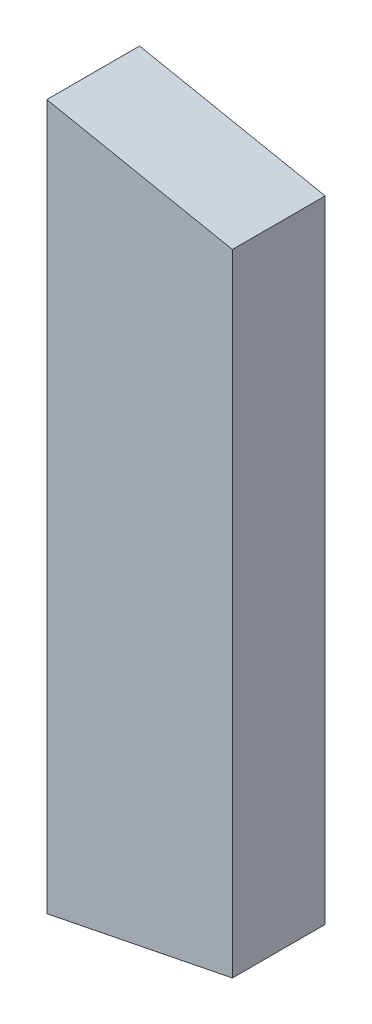
from build123d import *

# Parameters (mm, degrees)
SKETCH1_W           = 10
SKETCH1_H           = 38
BOSS_EXTRUDE1_DEPTH = 5
CUT_EXTRUDE1_DEPTH  = 27


with BuildPart() as part:
    # Sketch1 → Boss-Extrude1 (new body)
    with BuildSketch(Plane.XY):
        Rectangle(SKETCH1_W, SKETCH1_H)
    extrude(amount=BOSS_EXTRUDE1_DEPTH)

    # Sketch2 → Cut-Extrude1 (cut)
    with BuildSketch(Plane.XY.offset(5)):
        Polygon((-5, 19), (10, 16.002809057), (10, -16.002809057), (-5, -19), (-5, -28.706643241), (20.481775337, -28.706643241), (20.481775337, 22.293356759), (-5.034485411, 22.293356759), align=None)
    extrude(amount=-CUT_EXTRUDE1_DEPTH, mode=Mode.SUBTRACT)


solid = part.part
